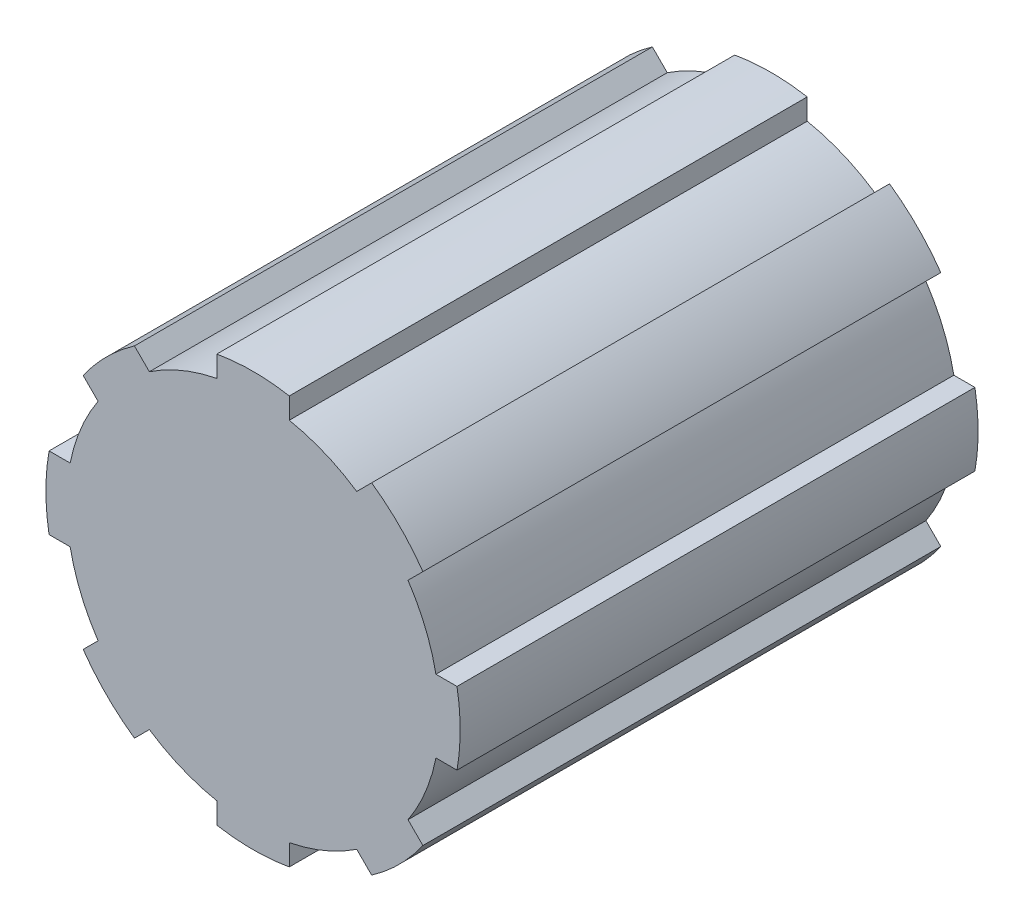
from build123d import *

# Parameters (mm, degrees)
SKETCH1_R           = 18
BASEKEY_DEPTH       = 25
RECTANGLE_DEPTH     = 25
RECTANGLEPAT_COUNT  = 8
SKETCH_1_R          = 10
CUT_EXTRUDE_1_DEPTH = 22
CUT_EXTRUDE_2_DEPTH = 14


with BuildPart() as part:
    # Sketch1 → BaseKey (new, symmetric)
    with BuildSketch(Plane.XY):
        Circle(SKETCH1_R)
    extrude(amount=BASEKEY_DEPTH, both=True)

    # Sketch2 → Rectangle (add, symmetric)
    with BuildSketch(Plane.XY):
        with BuildLine():
            Line((-3.5, 19.691368668), (-3.5, 0))
            Line((-3.5, 0), (3.5, 0))
            Line((3.5, 0), (3.5, 19.691368668))
            ThreePointArc((3.5, 19.691368668), (0, 20), (-3.5, 19.691368668))
        make_face()
    rectangle = extrude(amount=RECTANGLE_DEPTH, both=True)

    # RectanglePat: Rectangle ×8 about axis
    rectanglepat_axis = Axis((0, 0, 0), (0, 0, 1))
    for i in range(1, RECTANGLEPAT_COUNT):
        add(rectangle.rotate(rectanglepat_axis, i * 360 / RECTANGLEPAT_COUNT))

    # 草图1 → 切除-拉伸1 (cut)
    with BuildSketch(Plane(origin=(0, 0, -25), x_dir=(-1, 0, 0), z_dir=(0, 0, -1))):
        Circle(SKETCH_1_R)
    extrude(amount=-CUT_EXTRUDE_1_DEPTH, mode=Mode.SUBTRACT)

    # 草图3 → 切除-拉伸2 (cut)
    with BuildSketch(Plane(origin=(0, 0, 0), x_dir=(1, 0, 0), z_dir=(0, 1, 0))):
        Polygon((5, 25), (-5, 25), (-5, 18), (-5, 3), (5, 3), (5, 18), align=None)
    extrude(amount=CUT_EXTRUDE_2_DEPTH, mode=Mode.SUBTRACT)


solid = part.part
